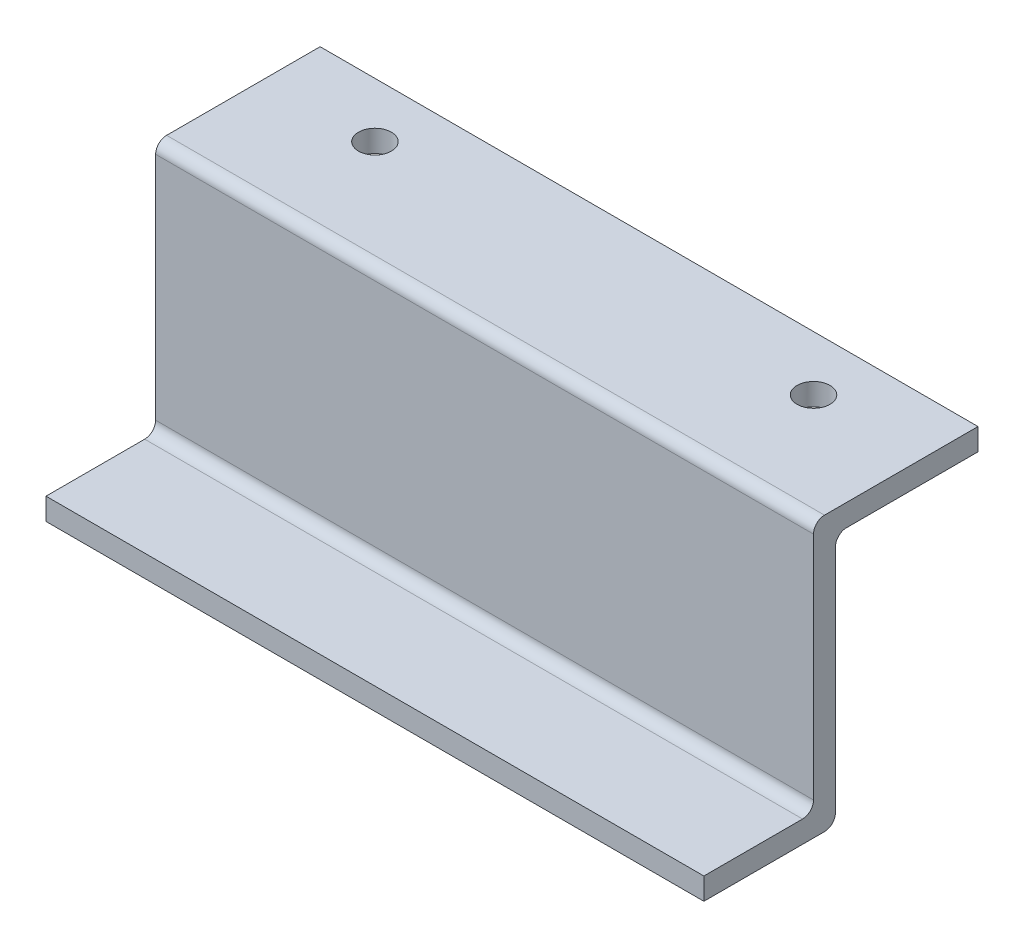
from build123d import *

# Parameters (mm, degrees)
BOSS_EXTRUDE1_DEPTH = 60
FILLET1_R           = 1
SKETCH2_R           = 1.5
CUT_EXTRUDE1_DEPTH  = 40


with BuildPart() as part:
    # Sketch1 → Boss-Extrude1 (new body)
    with BuildSketch(Plane(origin=(0, 0, 0), x_dir=(0, 0, -1), z_dir=(1, 0, 0))):
        Polygon((0, 2), (0, 0), (12, 0), (12, 23), (25, 23), (25, 25), (22, 25), (10, 25), (10, 2), align=None)
    extrude(amount=BOSS_EXTRUDE1_DEPTH)

    # Fillet1
    fillet1_edges = [part.edges().sort_by_distance(p)[0] for p in [
        (30, 23, -12),
        (30, 0, -12),
        (30, 2, -10),
        (30, 25, -10),
    ]]
    fillet(fillet1_edges, radius=FILLET1_R)

    # Sketch2 → Cut-Extrude1 (cut)
    with BuildSketch(Plane(origin=(0, 25, 0), x_dir=(1, 0, 0), z_dir=(0, 1, 0))):
        with Locations(Location((10, 20, 0), (0, 0, 270))):
            Circle(SKETCH2_R)
        with Locations(Location((50, 20, 0), (0, 0, 270))):
            Circle(SKETCH2_R)
    extrude(amount=-CUT_EXTRUDE1_DEPTH, mode=Mode.SUBTRACT)


solid = part.part
